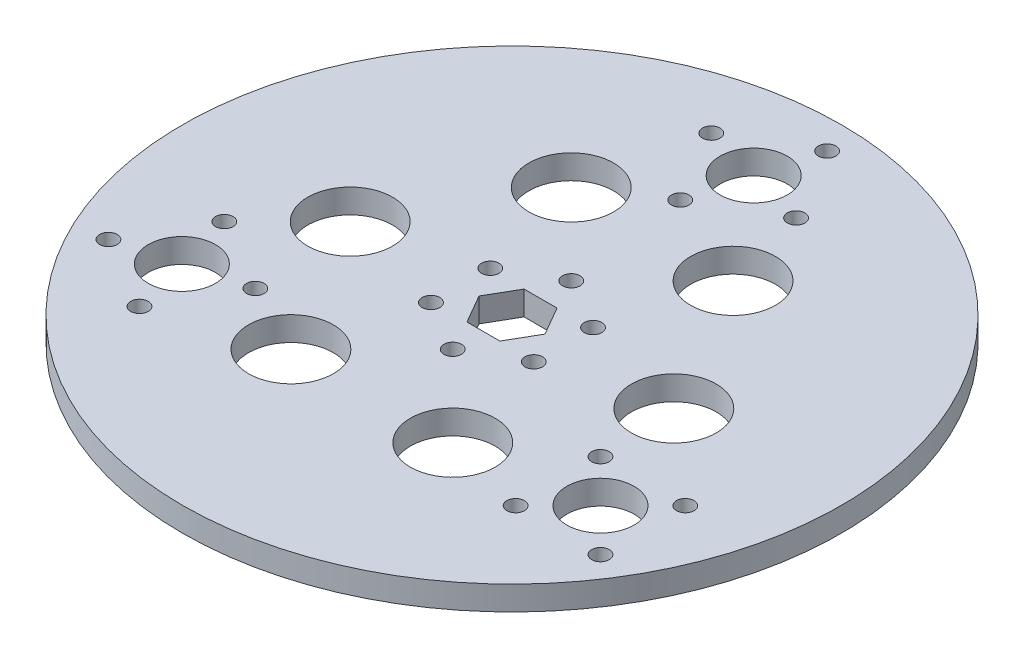
from build123d import *

# Parameters (mm, degrees)
SKETCH4_R           = 75
SKETCH4_R_2         = 9.65
SKETCH4_R_3         = 2
SKETCH4_R_4         = 7.65
BOSS_EXTRUDE1_DEPTH = 5.5


with BuildPart() as part:
    # Sketch4 → Boss-Extrude1 (new body)
    with BuildSketch(Plane(origin=(0, 0, 0), x_dir=(1, 0, 0), z_dir=(0, 1, 0))):
        with Locations(Location((0, 0, 0), (0, 0, 270))):
            Circle(SKETCH4_R)
        with Locations(Location((-36.827392181, 0, 0), (0, 0, 270))):
            Circle(SKETCH4_R_2, mode=Mode.SUBTRACT)
        with Locations(Location((-18.413696091, 31.893457184, 0), (0, 0, 270))):
            Circle(SKETCH4_R_2, mode=Mode.SUBTRACT)
        with Locations(Location((18.413696091, 31.893457184, 0), (0, 0, 270))):
            Circle(SKETCH4_R_2, mode=Mode.SUBTRACT)
        with Locations(Location((36.827392181, 0, 0), (0, 0, 270))):
            Circle(SKETCH4_R_2, mode=Mode.SUBTRACT)
        with Locations(Location((18.413696091, -31.893457184, 0), (0, 0, 270))):
            Circle(SKETCH4_R_2, mode=Mode.SUBTRACT)
        with Locations(Location((-18.413696091, -31.893457184, 0), (0, 0, 270))):
            Circle(SKETCH4_R_2, mode=Mode.SUBTRACT)
        with Locations(Location((0, 13.5, 0), (0, 0, 270))):
            Circle(SKETCH4_R_3, mode=Mode.SUBTRACT)
        with Locations(Location((11.691342951, 6.75, 0), (0, 0, 270))):
            Circle(SKETCH4_R_3, mode=Mode.SUBTRACT)
        with Locations(Location((11.691342951, -6.75, 0), (0, 0, 270))):
            Circle(SKETCH4_R_3, mode=Mode.SUBTRACT)
        with Locations(Location((0, -13.5, 0), (0, 0, 270))):
            Circle(SKETCH4_R_3, mode=Mode.SUBTRACT)
        with Locations(Location((-11.691342951, -6.75, 0), (0, 0, 270))):
            Circle(SKETCH4_R_3, mode=Mode.SUBTRACT)
        with Locations(Location((-11.691342951, 6.75, 0), (0, 0, 270))):
            Circle(SKETCH4_R_3, mode=Mode.SUBTRACT)
        with Locations(Location((0, 55, 0), (0, 0, 270))):
            Circle(SKETCH4_R_4, mode=Mode.SUBTRACT)
        with Locations(Location((47.631397208, -27.5, 0), (0, 0, 270))):
            Circle(SKETCH4_R_4, mode=Mode.SUBTRACT)
        with Locations(Location((-47.631397208, -27.5, 0), (0, 0, 270))):
            Circle(SKETCH4_R_4, mode=Mode.SUBTRACT)
        with Locations(Location((37.979389645, -37.152007563, 0), (0, 0, 270))):
            Circle(SKETCH4_R_3, mode=Mode.SUBTRACT)
        with Locations(Location((37.979389645, -17.847992437, 0), (0, 0, 270))):
            Circle(SKETCH4_R_3, mode=Mode.SUBTRACT)
        with Locations(Location((57.283404771, -17.847992437, 0), (0, 0, 270))):
            Circle(SKETCH4_R_3, mode=Mode.SUBTRACT)
        with Locations(Location((57.283404771, -37.152007563, 0), (0, 0, 270))):
            Circle(SKETCH4_R_3, mode=Mode.SUBTRACT)
        with Locations(Location((-51.164277174, -14.315112471, 0), (0, 0, 270))):
            Circle(SKETCH4_R_3, mode=Mode.SUBTRACT)
        with Locations(Location((-60.816284737, -31.032879966, 0), (0, 0, 270))):
            Circle(SKETCH4_R_3, mode=Mode.SUBTRACT)
        with Locations(Location((-44.098517242, -40.684887529, 0), (0, 0, 270))):
            Circle(SKETCH4_R_3, mode=Mode.SUBTRACT)
        with Locations(Location((-34.446509679, -23.967120034, 0), (0, 0, 270))):
            Circle(SKETCH4_R_3, mode=Mode.SUBTRACT)
        with Locations(Location((13.184887529, 51.467120034, 0), (0, 0, 270))):
            Circle(SKETCH4_R_3, mode=Mode.SUBTRACT)
        with Locations(Location((3.532879966, 68.184887529, 0), (0, 0, 270))):
            Circle(SKETCH4_R_3, mode=Mode.SUBTRACT)
        with Locations(Location((-13.184887529, 58.532879966, 0), (0, 0, 270))):
            Circle(SKETCH4_R_3, mode=Mode.SUBTRACT)
        with Locations(Location((-3.532879966, 41.815112471, 0), (0, 0, 270))):
            Circle(SKETCH4_R_3, mode=Mode.SUBTRACT)
        Polygon((3.75277675, -6.5), (7.505553499, 0), (3.75277675, 6.5), (-3.75277675, 6.5), (-7.505553499, 0), (-3.75277675, -6.5), align=None, mode=Mode.SUBTRACT)
    extrude(amount=BOSS_EXTRUDE1_DEPTH)


solid = part.part
